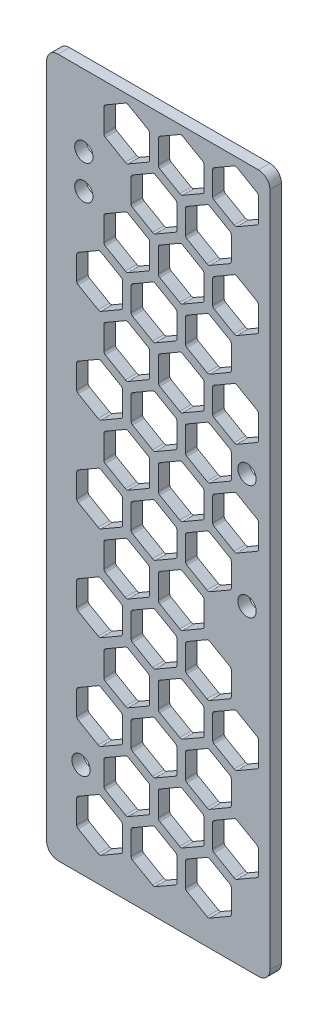
from build123d import *

# Parameters (mm, degrees)
SKETCH_1_R          = 1.6
EXTRUDE_1_DEPTH     = 2
SKETCH_3_W          = 13.038047159
SKETCH_3_H          = 8
SKETCH_3_W_2        = 14.361011955
CUT_EXTRUDE_2_DEPTH = 116.512986283
CUT_EXTRUDE_3_DEPTH = 114.570462709
FILLET_1_R          = 2


with BuildPart() as part:
    # 草图1 → 凸台-拉伸1 (new body)
    with BuildSketch(Plane.XY):
        Polygon((3, -11.5), (3, -16.5), (42, -16.5), (42, 8.5), (47, 8.5), (47, 16.5), (42, 16.5), (42, 72.5), (47, 72.5), (47, 80.5), (42, 80.5), (42, 105.5), (3, 105.5), align=None)
        with Locations((9, 0)):
            Circle(SKETCH_1_R, mode=Mode.SUBTRACT)
        with Locations((9.5, 93)):
            Circle(SKETCH_1_R, mode=Mode.SUBTRACT)
        with Locations((9.5, 87)):
            Circle(SKETCH_1_R, mode=Mode.SUBTRACT)
        with Locations((38, 38.5)):
            Circle(SKETCH_1_R, mode=Mode.SUBTRACT)
        with Locations((38, 58.5)):
            Circle(SKETCH_1_R, mode=Mode.SUBTRACT)
    extrude(amount=EXTRUDE_1_DEPTH)

    # 草图3 → 切除-拉伸2 (cut, through all)
    with BuildSketch(Plane.XY.offset(2)):
        with Locations((48.51902358, 76.5)):
            Rectangle(SKETCH_3_W, SKETCH_3_H)
        with Locations((49.180505978, 12.5)):
            Rectangle(SKETCH_3_W_2, SKETCH_3_H)
    extrude(amount=-CUT_EXTRUDE_2_DEPTH, mode=Mode.SUBTRACT)

    # 草图4 → 切除-拉伸3 (cut, through all)
    with BuildSketch(Plane.XY.offset(2)):
        with BuildLine():
            Line((35.75, 103.974464586), (32.25, 101.953738644))
            ThreePointArc((32.25, 101.953738644), (32.066987298, 101.770725942), (32, 101.520725942))
            Line((32, 101.520725942), (32, 97.479274058))
            ThreePointArc((32, 97.479274058), (32.066987298, 97.229274058), (32.25, 97.046261356))
            Line((32.25, 97.046261356), (35.75, 95.025535414))
            ThreePointArc((35.75, 95.025535414), (36, 94.958548116), (36.25, 95.025535414))
            Line((36.25, 95.025535414), (39.75, 97.046261356))
            ThreePointArc((39.75, 97.046261356), (39.933012702, 97.229274058), (40, 97.479274058))
            Line((40, 97.479274058), (40, 101.520725942))
            ThreePointArc((40, 101.520725942), (39.933012702, 101.770725942), (39.75, 101.953738644))
            Line((39.75, 101.953738644), (36.25, 103.974464586))
            ThreePointArc((36.25, 103.974464586), (36, 104.041451884), (35.75, 103.974464586))
        make_face()
        with BuildLine():
            Line((26.25, 103.974464586), (22.75, 101.953738644))
            ThreePointArc((22.75, 101.953738644), (22.566987298, 101.770725942), (22.5, 101.520725942))
            Line((22.5, 101.520725942), (22.5, 97.479274058))
            ThreePointArc((22.5, 97.479274058), (22.566987298, 97.229274058), (22.75, 97.046261356))
            Line((22.75, 97.046261356), (26.25, 95.025535414))
            ThreePointArc((26.25, 95.025535414), (26.5, 94.958548116), (26.75, 95.025535414))
            Line((26.75, 95.025535414), (30.25, 97.046261356))
            ThreePointArc((30.25, 97.046261356), (30.433012702, 97.229274058), (30.5, 97.479274058))
            Line((30.5, 97.479274058), (30.5, 101.520725942))
            ThreePointArc((30.5, 101.520725942), (30.433012702, 101.770725942), (30.25, 101.953738644))
            Line((30.25, 101.953738644), (26.75, 103.974464586))
            ThreePointArc((26.75, 103.974464586), (26.5, 104.041451884), (26.25, 103.974464586))
        make_face()
        with BuildLine():
            Line((16.75, 103.974464586), (13.25, 101.953738644))
            ThreePointArc((13.25, 101.953738644), (13.066987298, 101.770725942), (13, 101.520725942))
            Line((13, 101.520725942), (13, 97.479274058))
            ThreePointArc((13, 97.479274058), (13.066987298, 97.229274058), (13.25, 97.046261356))
            Line((13.25, 97.046261356), (16.75, 95.025535414))
            ThreePointArc((16.75, 95.025535414), (17, 94.958548116), (17.25, 95.025535414))
            Line((17.25, 95.025535414), (20.75, 97.046261356))
            ThreePointArc((20.75, 97.046261356), (20.933012702, 97.229274058), (21, 97.479274058))
            Line((21, 97.479274058), (21, 101.520725942))
            ThreePointArc((21, 101.520725942), (20.933012702, 101.770725942), (20.75, 101.953738644))
            Line((20.75, 101.953738644), (17.25, 103.974464586))
            ThreePointArc((17.25, 103.974464586), (17, 104.041451884), (16.75, 103.974464586))
        make_face()
        with BuildLine():
            Line((21.5, 95.74722325), (18, 93.726497308))
            ThreePointArc((18, 93.726497308), (17.816987298, 93.543484606), (17.75, 93.293484606))
            Line((17.75, 93.293484606), (17.75, 89.252032722))
            ThreePointArc((17.75, 89.252032722), (17.816987298, 89.002032722), (18, 88.81902002))
            Line((18, 88.81902002), (21.5, 86.798294078))
            ThreePointArc((21.5, 86.798294078), (21.75, 86.73130678), (22, 86.798294078))
            Line((22, 86.798294078), (25.5, 88.81902002))
            ThreePointArc((25.5, 88.81902002), (25.683012702, 89.002032722), (25.75, 89.252032722))
            Line((25.75, 89.252032722), (25.75, 93.293484606))
            ThreePointArc((25.75, 93.293484606), (25.683012702, 93.543484606), (25.5, 93.726497308))
            Line((25.5, 93.726497308), (22, 95.74722325))
            ThreePointArc((22, 95.74722325), (21.75, 95.814210548), (21.5, 95.74722325))
        make_face()
        with BuildLine():
            Line((31, 95.74722325), (27.5, 93.726497308))
            ThreePointArc((27.5, 93.726497308), (27.316987298, 93.543484606), (27.25, 93.293484606))
            Line((27.25, 93.293484606), (27.25, 89.252032722))
            ThreePointArc((27.25, 89.252032722), (27.316987298, 89.002032722), (27.5, 88.81902002))
            Line((27.5, 88.81902002), (31, 86.798294078))
            ThreePointArc((31, 86.798294078), (31.25, 86.73130678), (31.5, 86.798294078))
            Line((31.5, 86.798294078), (35, 88.81902002))
            ThreePointArc((35, 88.81902002), (35.183012702, 89.002032722), (35.25, 89.252032722))
            Line((35.25, 89.252032722), (35.25, 93.293484606))
            ThreePointArc((35.25, 93.293484606), (35.183012702, 93.543484606), (35, 93.726497308))
            Line((35, 93.726497308), (31.5, 95.74722325))
            ThreePointArc((31.5, 95.74722325), (31.25, 95.814210548), (31, 95.74722325))
        make_face()
        with BuildLine():
            Line((26.25, 87.519981914), (22.75, 85.499255972))
            ThreePointArc((22.75, 85.499255972), (22.566987298, 85.31624327), (22.5, 85.06624327))
            Line((22.5, 85.06624327), (22.5, 81.024791386))
            ThreePointArc((22.5, 81.024791386), (22.566987298, 80.774791386), (22.75, 80.591778684))
            Line((22.75, 80.591778684), (26.25, 78.571052742))
            ThreePointArc((26.25, 78.571052742), (26.5, 78.504065444), (26.75, 78.571052742))
            Line((26.75, 78.571052742), (30.25, 80.591778684))
            ThreePointArc((30.25, 80.591778684), (30.433012702, 80.774791386), (30.5, 81.024791386))
            Line((30.5, 81.024791386), (30.5, 85.06624327))
            ThreePointArc((30.5, 85.06624327), (30.433012702, 85.31624327), (30.25, 85.499255972))
            Line((30.25, 85.499255972), (26.75, 87.519981914))
            ThreePointArc((26.75, 87.519981914), (26.5, 87.586969212), (26.25, 87.519981914))
        make_face()
        with BuildLine():
            Line((35.75, 87.519981914), (32.25, 85.499255972))
            ThreePointArc((32.25, 85.499255972), (32.066987298, 85.31624327), (32, 85.06624327))
            Line((32, 85.06624327), (32, 81.024791386))
            ThreePointArc((32, 81.024791386), (32.066987298, 80.774791386), (32.25, 80.591778684))
            Line((32.25, 80.591778684), (35.75, 78.571052742))
            ThreePointArc((35.75, 78.571052742), (36, 78.504065444), (36.25, 78.571052742))
            Line((36.25, 78.571052742), (39.75, 80.591778684))
            ThreePointArc((39.75, 80.591778684), (39.933012702, 80.774791386), (40, 81.024791386))
            Line((40, 81.024791386), (40, 85.06624327))
            ThreePointArc((40, 85.06624327), (39.933012702, 85.31624327), (39.75, 85.499255972))
            Line((39.75, 85.499255972), (36.25, 87.519981914))
            ThreePointArc((36.25, 87.519981914), (36, 87.586969212), (35.75, 87.519981914))
        make_face()
        with BuildLine():
            Line((16.75, 87.519981914), (13.25, 85.499255972))
            ThreePointArc((13.25, 85.499255972), (13.066987298, 85.31624327), (13, 85.06624327))
            Line((13, 85.06624327), (13, 81.024791386))
            ThreePointArc((13, 81.024791386), (13.066987298, 80.774791386), (13.25, 80.591778684))
            Line((13.25, 80.591778684), (16.75, 78.571052742))
            ThreePointArc((16.75, 78.571052742), (17, 78.504065444), (17.25, 78.571052742))
            Line((17.25, 78.571052742), (20.75, 80.591778684))
            ThreePointArc((20.75, 80.591778684), (20.933012702, 80.774791386), (21, 81.024791386))
            Line((21, 81.024791386), (21, 85.06624327))
            ThreePointArc((21, 85.06624327), (20.933012702, 85.31624327), (20.75, 85.499255972))
            Line((20.75, 85.499255972), (17.25, 87.519981914))
            ThreePointArc((17.25, 87.519981914), (17, 87.586969212), (16.75, 87.519981914))
        make_face()
        with BuildLine():
            Line((21.5, 79.292740578), (18, 77.272014636))
            ThreePointArc((18, 77.272014636), (17.816987298, 77.089001934), (17.75, 76.839001934))
            Line((17.75, 76.839001934), (17.75, 72.79755005))
            ThreePointArc((17.75, 72.79755005), (17.816987298, 72.54755005), (18, 72.364537348))
            Line((18, 72.364537348), (21.5, 70.343811406))
            ThreePointArc((21.5, 70.343811406), (21.75, 70.276824108), (22, 70.343811406))
            Line((22, 70.343811406), (25.5, 72.364537348))
            ThreePointArc((25.5, 72.364537348), (25.683012702, 72.54755005), (25.75, 72.79755005))
            Line((25.75, 72.79755005), (25.75, 76.839001934))
            ThreePointArc((25.75, 76.839001934), (25.683012702, 77.089001934), (25.5, 77.272014636))
            Line((25.5, 77.272014636), (22, 79.292740578))
            ThreePointArc((22, 79.292740578), (21.75, 79.359727876), (21.5, 79.292740578))
        make_face()
        with BuildLine():
            Line((31, 79.292740578), (27.5, 77.272014636))
            ThreePointArc((27.5, 77.272014636), (27.316987298, 77.089001934), (27.25, 76.839001934))
            Line((27.25, 76.839001934), (27.25, 72.79755005))
            ThreePointArc((27.25, 72.79755005), (27.316987298, 72.54755005), (27.5, 72.364537348))
            Line((27.5, 72.364537348), (31, 70.343811406))
            ThreePointArc((31, 70.343811406), (31.25, 70.276824108), (31.5, 70.343811406))
            Line((31.5, 70.343811406), (35, 72.364537348))
            ThreePointArc((35, 72.364537348), (35.183012702, 72.54755005), (35.25, 72.79755005))
            Line((35.25, 72.79755005), (35.25, 76.839001934))
            ThreePointArc((35.25, 76.839001934), (35.183012702, 77.089001934), (35, 77.272014636))
            Line((35, 77.272014636), (31.5, 79.292740578))
            ThreePointArc((31.5, 79.292740578), (31.25, 79.359727876), (31, 79.292740578))
        make_face()
        with BuildLine():
            Line((12, 79.292740578), (8.5, 77.272014636))
            ThreePointArc((8.5, 77.272014636), (8.316987298, 77.089001934), (8.25, 76.839001934))
            Line((8.25, 76.839001934), (8.25, 72.79755005))
            ThreePointArc((8.25, 72.79755005), (8.316987298, 72.54755005), (8.5, 72.364537348))
            Line((8.5, 72.364537348), (12, 70.343811406))
            ThreePointArc((12, 70.343811406), (12.25, 70.276824108), (12.5, 70.343811406))
            Line((12.5, 70.343811406), (16, 72.364537348))
            ThreePointArc((16, 72.364537348), (16.183012702, 72.54755005), (16.25, 72.79755005))
            Line((16.25, 72.79755005), (16.25, 76.839001934))
            ThreePointArc((16.25, 76.839001934), (16.183012702, 77.089001934), (16, 77.272014636))
            Line((16, 77.272014636), (12.5, 79.292740578))
            ThreePointArc((12.5, 79.292740578), (12.25, 79.359727876), (12, 79.292740578))
        make_face()
        with BuildLine():
            Line((16.75, 71.065499242), (13.25, 69.0447733))
            ThreePointArc((13.25, 69.0447733), (13.066987298, 68.861760598), (13, 68.611760598))
            Line((13, 68.611760598), (13, 64.570308714))
            ThreePointArc((13, 64.570308714), (13.066987298, 64.320308714), (13.25, 64.137296012))
            Line((13.25, 64.137296012), (16.75, 62.11657007))
            ThreePointArc((16.75, 62.11657007), (17, 62.049582772), (17.25, 62.11657007))
            Line((17.25, 62.11657007), (20.75, 64.137296012))
            ThreePointArc((20.75, 64.137296012), (20.933012702, 64.320308714), (21, 64.570308714))
            Line((21, 64.570308714), (21, 68.611760598))
            ThreePointArc((21, 68.611760598), (20.933012702, 68.861760598), (20.75, 69.0447733))
            Line((20.75, 69.0447733), (17.25, 71.065499242))
            ThreePointArc((17.25, 71.065499242), (17, 71.132486541), (16.75, 71.065499242))
        make_face()
        with BuildLine():
            Line((26.25, 71.065499242), (22.75, 69.0447733))
            ThreePointArc((22.75, 69.0447733), (22.566987298, 68.861760598), (22.5, 68.611760598))
            Line((22.5, 68.611760598), (22.5, 64.570308714))
            ThreePointArc((22.5, 64.570308714), (22.566987298, 64.320308714), (22.75, 64.137296012))
            Line((22.75, 64.137296012), (26.25, 62.11657007))
            ThreePointArc((26.25, 62.11657007), (26.5, 62.049582772), (26.75, 62.11657007))
            Line((26.75, 62.11657007), (30.25, 64.137296012))
            ThreePointArc((30.25, 64.137296012), (30.433012702, 64.320308714), (30.5, 64.570308714))
            Line((30.5, 64.570308714), (30.5, 68.611760598))
            ThreePointArc((30.5, 68.611760598), (30.433012702, 68.861760598), (30.25, 69.0447733))
            Line((30.25, 69.0447733), (26.75, 71.065499242))
            ThreePointArc((26.75, 71.065499242), (26.5, 71.132486541), (26.25, 71.065499242))
        make_face()
        with BuildLine():
            Line((35.75, 71.065499242), (32.25, 69.0447733))
            ThreePointArc((32.25, 69.0447733), (32.066987298, 68.861760598), (32, 68.611760598))
            Line((32, 68.611760598), (32, 64.570308714))
            ThreePointArc((32, 64.570308714), (32.066987298, 64.320308714), (32.25, 64.137296012))
            Line((32.25, 64.137296012), (35.75, 62.11657007))
            ThreePointArc((35.75, 62.11657007), (36, 62.049582772), (36.25, 62.11657007))
            Line((36.25, 62.11657007), (39.75, 64.137296012))
            ThreePointArc((39.75, 64.137296012), (39.933012702, 64.320308714), (40, 64.570308714))
            Line((40, 64.570308714), (40, 68.611760598))
            ThreePointArc((40, 68.611760598), (39.933012702, 68.861760598), (39.75, 69.0447733))
            Line((39.75, 69.0447733), (36.25, 71.065499242))
            ThreePointArc((36.25, 71.065499242), (36, 71.132486541), (35.75, 71.065499242))
        make_face()
        with BuildLine():
            Line((31, 62.838257906), (27.5, 60.817531964))
            ThreePointArc((27.5, 60.817531964), (27.316987298, 60.634519262), (27.25, 60.384519262))
            Line((27.25, 60.384519262), (27.25, 56.343067378))
            ThreePointArc((27.25, 56.343067378), (27.316987298, 56.093067378), (27.5, 55.910054676))
            Line((27.5, 55.910054676), (31, 53.889328734))
            ThreePointArc((31, 53.889328734), (31.25, 53.822341436), (31.5, 53.889328734))
            Line((31.5, 53.889328734), (35, 55.910054676))
            ThreePointArc((35, 55.910054676), (35.183012702, 56.093067378), (35.25, 56.343067378))
            Line((35.25, 56.343067378), (35.25, 60.384519262))
            ThreePointArc((35.25, 60.384519262), (35.183012702, 60.634519262), (35, 60.817531964))
            Line((35, 60.817531964), (31.5, 62.838257906))
            ThreePointArc((31.5, 62.838257906), (31.25, 62.905245205), (31, 62.838257906))
        make_face()
        with BuildLine():
            Line((21.5, 62.838257906), (18, 60.817531964))
            ThreePointArc((18, 60.817531964), (17.816987298, 60.634519262), (17.75, 60.384519262))
            Line((17.75, 60.384519262), (17.75, 56.343067378))
            ThreePointArc((17.75, 56.343067378), (17.816987298, 56.093067378), (18, 55.910054676))
            Line((18, 55.910054676), (21.5, 53.889328734))
            ThreePointArc((21.5, 53.889328734), (21.75, 53.822341436), (22, 53.889328734))
            Line((22, 53.889328734), (25.5, 55.910054676))
            ThreePointArc((25.5, 55.910054676), (25.683012702, 56.093067378), (25.75, 56.343067378))
            Line((25.75, 56.343067378), (25.75, 60.384519262))
            ThreePointArc((25.75, 60.384519262), (25.683012702, 60.634519262), (25.5, 60.817531964))
            Line((25.5, 60.817531964), (22, 62.838257906))
            ThreePointArc((22, 62.838257906), (21.75, 62.905245205), (21.5, 62.838257906))
        make_face()
        with BuildLine():
            Line((12, 62.838257906), (8.5, 60.817531964))
            ThreePointArc((8.5, 60.817531964), (8.316987298, 60.634519262), (8.25, 60.384519262))
            Line((8.25, 60.384519262), (8.25, 56.343067378))
            ThreePointArc((8.25, 56.343067378), (8.316987298, 56.093067378), (8.5, 55.910054676))
            Line((8.5, 55.910054676), (12, 53.889328734))
            ThreePointArc((12, 53.889328734), (12.25, 53.822341436), (12.5, 53.889328734))
            Line((12.5, 53.889328734), (16, 55.910054676))
            ThreePointArc((16, 55.910054676), (16.183012702, 56.093067378), (16.25, 56.343067378))
            Line((16.25, 56.343067378), (16.25, 60.384519262))
            ThreePointArc((16.25, 60.384519262), (16.183012702, 60.634519262), (16, 60.817531964))
            Line((16, 60.817531964), (12.5, 62.838257906))
            ThreePointArc((12.5, 62.838257906), (12.25, 62.905245205), (12, 62.838257906))
        make_face()
        with BuildLine():
            Line((16.75, 54.611016571), (13.25, 52.590290628))
            ThreePointArc((13.25, 52.590290628), (13.066987298, 52.407277926), (13, 52.157277926))
            Line((13, 52.157277926), (13, 48.115826042))
            ThreePointArc((13, 48.115826042), (13.066987298, 47.865826042), (13.25, 47.68281334))
            Line((13.25, 47.68281334), (16.75, 45.662087398))
            ThreePointArc((16.75, 45.662087398), (17, 45.5951001), (17.25, 45.662087398))
            Line((17.25, 45.662087398), (20.75, 47.68281334))
            ThreePointArc((20.75, 47.68281334), (20.933012702, 47.865826042), (21, 48.115826042))
            Line((21, 48.115826042), (21, 52.157277926))
            ThreePointArc((21, 52.157277926), (20.933012702, 52.407277926), (20.75, 52.590290628))
            Line((20.75, 52.590290628), (17.25, 54.611016571))
            ThreePointArc((17.25, 54.611016571), (17, 54.678003869), (16.75, 54.611016571))
        make_face()
        with BuildLine():
            Line((26.25, 54.611016571), (22.75, 52.590290628))
            ThreePointArc((22.75, 52.590290628), (22.566987298, 52.407277926), (22.5, 52.157277926))
            Line((22.5, 52.157277926), (22.5, 48.115826042))
            ThreePointArc((22.5, 48.115826042), (22.566987298, 47.865826042), (22.75, 47.68281334))
            Line((22.75, 47.68281334), (26.25, 45.662087398))
            ThreePointArc((26.25, 45.662087398), (26.5, 45.5951001), (26.75, 45.662087398))
            Line((26.75, 45.662087398), (30.25, 47.68281334))
            ThreePointArc((30.25, 47.68281334), (30.433012702, 47.865826042), (30.5, 48.115826042))
            Line((30.5, 48.115826042), (30.5, 52.157277926))
            ThreePointArc((30.5, 52.157277926), (30.433012702, 52.407277926), (30.25, 52.590290628))
            Line((30.25, 52.590290628), (26.75, 54.611016571))
            ThreePointArc((26.75, 54.611016571), (26.5, 54.678003869), (26.25, 54.611016571))
        make_face()
        with BuildLine():
            Line((35.75, 54.611016571), (32.25, 52.590290628))
            ThreePointArc((32.25, 52.590290628), (32.066987298, 52.407277926), (32, 52.157277926))
            Line((32, 52.157277926), (32, 48.115826042))
            ThreePointArc((32, 48.115826042), (32.066987298, 47.865826042), (32.25, 47.68281334))
            Line((32.25, 47.68281334), (35.75, 45.662087398))
            ThreePointArc((35.75, 45.662087398), (36, 45.5951001), (36.25, 45.662087398))
            Line((36.25, 45.662087398), (39.75, 47.68281334))
            ThreePointArc((39.75, 47.68281334), (39.933012702, 47.865826042), (40, 48.115826042))
            Line((40, 48.115826042), (40, 52.157277926))
            ThreePointArc((40, 52.157277926), (39.933012702, 52.407277926), (39.75, 52.590290628))
            Line((39.75, 52.590290628), (36.25, 54.611016571))
            ThreePointArc((36.25, 54.611016571), (36, 54.678003869), (35.75, 54.611016571))
        make_face()
        with BuildLine():
            Line((31, 46.383775235), (27.5, 44.363049292))
            ThreePointArc((27.5, 44.363049292), (27.316987298, 44.18003659), (27.25, 43.93003659))
            Line((27.25, 43.93003659), (27.25, 39.888584706))
            ThreePointArc((27.25, 39.888584706), (27.316987298, 39.638584706), (27.5, 39.455572004))
            Line((27.5, 39.455572004), (31, 37.434846062))
            ThreePointArc((31, 37.434846062), (31.25, 37.367858764), (31.5, 37.434846062))
            Line((31.5, 37.434846062), (35, 39.455572004))
            ThreePointArc((35, 39.455572004), (35.183012702, 39.638584706), (35.25, 39.888584706))
            Line((35.25, 39.888584706), (35.25, 43.93003659))
            ThreePointArc((35.25, 43.93003659), (35.183012702, 44.18003659), (35, 44.363049292))
            Line((35, 44.363049292), (31.5, 46.383775235))
            ThreePointArc((31.5, 46.383775235), (31.25, 46.450762533), (31, 46.383775235))
        make_face()
        with BuildLine():
            Line((21.5, 46.383775235), (18, 44.363049292))
            ThreePointArc((18, 44.363049292), (17.816987298, 44.18003659), (17.75, 43.93003659))
            Line((17.75, 43.93003659), (17.75, 39.888584706))
            ThreePointArc((17.75, 39.888584706), (17.816987298, 39.638584706), (18, 39.455572004))
            Line((18, 39.455572004), (21.5, 37.434846062))
            ThreePointArc((21.5, 37.434846062), (21.75, 37.367858764), (22, 37.434846062))
            Line((22, 37.434846062), (25.5, 39.455572004))
            ThreePointArc((25.5, 39.455572004), (25.683012702, 39.638584706), (25.75, 39.888584706))
            Line((25.75, 39.888584706), (25.75, 43.93003659))
            ThreePointArc((25.75, 43.93003659), (25.683012702, 44.18003659), (25.5, 44.363049292))
            Line((25.5, 44.363049292), (22, 46.383775235))
            ThreePointArc((22, 46.383775235), (21.75, 46.450762533), (21.5, 46.383775235))
        make_face()
        with BuildLine():
            Line((12, 46.383775235), (8.5, 44.363049292))
            ThreePointArc((8.5, 44.363049292), (8.316987298, 44.18003659), (8.25, 43.93003659))
            Line((8.25, 43.93003659), (8.25, 39.888584706))
            ThreePointArc((8.25, 39.888584706), (8.316987298, 39.638584706), (8.5, 39.455572004))
            Line((8.5, 39.455572004), (12, 37.434846062))
            ThreePointArc((12, 37.434846062), (12.25, 37.367858764), (12.5, 37.434846062))
            Line((12.5, 37.434846062), (16, 39.455572004))
            ThreePointArc((16, 39.455572004), (16.183012702, 39.638584706), (16.25, 39.888584706))
            Line((16.25, 39.888584706), (16.25, 43.93003659))
            ThreePointArc((16.25, 43.93003659), (16.183012702, 44.18003659), (16, 44.363049292))
            Line((16, 44.363049292), (12.5, 46.383775235))
            ThreePointArc((12.5, 46.383775235), (12.25, 46.450762533), (12, 46.383775235))
        make_face()
        with BuildLine():
            Line((16.75, 38.156533899), (13.25, 36.135807956))
            ThreePointArc((13.25, 36.135807956), (13.066987298, 35.952795255), (13, 35.702795255))
            Line((13, 35.702795255), (13, 31.66134337))
            ThreePointArc((13, 31.66134337), (13.066987298, 31.41134337), (13.25, 31.228330668))
            Line((13.25, 31.228330668), (16.75, 29.207604726))
            ThreePointArc((16.75, 29.207604726), (17, 29.140617428), (17.25, 29.207604726))
            Line((17.25, 29.207604726), (20.75, 31.228330668))
            ThreePointArc((20.75, 31.228330668), (20.933012702, 31.41134337), (21, 31.66134337))
            Line((21, 31.66134337), (21, 35.702795255))
            ThreePointArc((21, 35.702795255), (20.933012702, 35.952795255), (20.75, 36.135807956))
            Line((20.75, 36.135807956), (17.25, 38.156533899))
            ThreePointArc((17.25, 38.156533899), (17, 38.223521197), (16.75, 38.156533899))
        make_face()
        with BuildLine():
            Line((26.25, 38.156533899), (22.75, 36.135807956))
            ThreePointArc((22.75, 36.135807956), (22.566987298, 35.952795255), (22.5, 35.702795255))
            Line((22.5, 35.702795255), (22.5, 31.66134337))
            ThreePointArc((22.5, 31.66134337), (22.566987298, 31.41134337), (22.75, 31.228330668))
            Line((22.75, 31.228330668), (26.25, 29.207604726))
            ThreePointArc((26.25, 29.207604726), (26.5, 29.140617428), (26.75, 29.207604726))
            Line((26.75, 29.207604726), (30.25, 31.228330668))
            ThreePointArc((30.25, 31.228330668), (30.433012702, 31.41134337), (30.5, 31.66134337))
            Line((30.5, 31.66134337), (30.5, 35.702795255))
            ThreePointArc((30.5, 35.702795255), (30.433012702, 35.952795255), (30.25, 36.135807956))
            Line((30.25, 36.135807956), (26.75, 38.156533899))
            ThreePointArc((26.75, 38.156533899), (26.5, 38.223521197), (26.25, 38.156533899))
        make_face()
        with BuildLine():
            Line((31, 29.929292563), (27.5, 27.90856662))
            ThreePointArc((27.5, 27.90856662), (27.316987298, 27.725553919), (27.25, 27.475553919))
            Line((27.25, 27.475553919), (27.25, 23.434102034))
            ThreePointArc((27.25, 23.434102034), (27.316987298, 23.184102034), (27.5, 23.001089332))
            Line((27.5, 23.001089332), (31, 20.98036339))
            ThreePointArc((31, 20.98036339), (31.25, 20.913376092), (31.5, 20.98036339))
            Line((31.5, 20.98036339), (35, 23.001089332))
            ThreePointArc((35, 23.001089332), (35.183012702, 23.184102034), (35.25, 23.434102034))
            Line((35.25, 23.434102034), (35.25, 27.475553919))
            ThreePointArc((35.25, 27.475553919), (35.183012702, 27.725553919), (35, 27.90856662))
            Line((35, 27.90856662), (31.5, 29.929292563))
            ThreePointArc((31.5, 29.929292563), (31.25, 29.996279861), (31, 29.929292563))
        make_face()
        with BuildLine():
            Line((21.5, 29.929292563), (18, 27.90856662))
            ThreePointArc((18, 27.90856662), (17.816987298, 27.725553919), (17.75, 27.475553919))
            Line((17.75, 27.475553919), (17.75, 23.434102034))
            ThreePointArc((17.75, 23.434102034), (17.816987298, 23.184102034), (18, 23.001089332))
            Line((18, 23.001089332), (21.5, 20.98036339))
            ThreePointArc((21.5, 20.98036339), (21.75, 20.913376092), (22, 20.98036339))
            Line((22, 20.98036339), (25.5, 23.001089332))
            ThreePointArc((25.5, 23.001089332), (25.683012702, 23.184102034), (25.75, 23.434102034))
            Line((25.75, 23.434102034), (25.75, 27.475553919))
            ThreePointArc((25.75, 27.475553919), (25.683012702, 27.725553919), (25.5, 27.90856662))
            Line((25.5, 27.90856662), (22, 29.929292563))
            ThreePointArc((22, 29.929292563), (21.75, 29.996279861), (21.5, 29.929292563))
        make_face()
        with BuildLine():
            Line((12, 29.929292563), (8.5, 27.90856662))
            ThreePointArc((8.5, 27.90856662), (8.316987298, 27.725553919), (8.25, 27.475553919))
            Line((8.25, 27.475553919), (8.25, 23.434102034))
            ThreePointArc((8.25, 23.434102034), (8.316987298, 23.184102034), (8.5, 23.001089332))
            Line((8.5, 23.001089332), (12, 20.98036339))
            ThreePointArc((12, 20.98036339), (12.25, 20.913376092), (12.5, 20.98036339))
            Line((12.5, 20.98036339), (16, 23.001089332))
            ThreePointArc((16, 23.001089332), (16.183012702, 23.184102034), (16.25, 23.434102034))
            Line((16.25, 23.434102034), (16.25, 27.475553919))
            ThreePointArc((16.25, 27.475553919), (16.183012702, 27.725553919), (16, 27.90856662))
            Line((16, 27.90856662), (12.5, 29.929292563))
            ThreePointArc((12.5, 29.929292563), (12.25, 29.996279861), (12, 29.929292563))
        make_face()
        with BuildLine():
            Line((16.75, 21.702051227), (13.25, 19.681325285))
            ThreePointArc((13.25, 19.681325285), (13.066987298, 19.498312583), (13, 19.248312583))
            Line((13, 19.248312583), (13, 15.206860698))
            ThreePointArc((13, 15.206860698), (13.066987298, 14.956860698), (13.25, 14.773847996))
            Line((13.25, 14.773847996), (16.75, 12.753122054))
            ThreePointArc((16.75, 12.753122054), (17, 12.686134756), (17.25, 12.753122054))
            Line((17.25, 12.753122054), (20.75, 14.773847996))
            ThreePointArc((20.75, 14.773847996), (20.933012702, 14.956860698), (21, 15.206860698))
            Line((21, 15.206860698), (21, 19.248312583))
            ThreePointArc((21, 19.248312583), (20.933012702, 19.498312583), (20.75, 19.681325285))
            Line((20.75, 19.681325285), (17.25, 21.702051227))
            ThreePointArc((17.25, 21.702051227), (17, 21.769038525), (16.75, 21.702051227))
        make_face()
        with BuildLine():
            Line((26.25, 21.702051227), (22.75, 19.681325285))
            ThreePointArc((22.75, 19.681325285), (22.566987298, 19.498312583), (22.5, 19.248312583))
            Line((22.5, 19.248312583), (22.5, 15.206860698))
            ThreePointArc((22.5, 15.206860698), (22.566987298, 14.956860698), (22.75, 14.773847996))
            Line((22.75, 14.773847996), (26.25, 12.753122054))
            ThreePointArc((26.25, 12.753122054), (26.5, 12.686134756), (26.75, 12.753122054))
            Line((26.75, 12.753122054), (30.25, 14.773847996))
            ThreePointArc((30.25, 14.773847996), (30.433012702, 14.956860698), (30.5, 15.206860698))
            Line((30.5, 15.206860698), (30.5, 19.248312583))
            ThreePointArc((30.5, 19.248312583), (30.433012702, 19.498312583), (30.25, 19.681325285))
            Line((30.25, 19.681325285), (26.75, 21.702051227))
            ThreePointArc((26.75, 21.702051227), (26.5, 21.769038525), (26.25, 21.702051227))
        make_face()
        with BuildLine():
            Line((35.75, 21.702051227), (32.25, 19.681325285))
            ThreePointArc((32.25, 19.681325285), (32.066987298, 19.498312583), (32, 19.248312583))
            Line((32, 19.248312583), (32, 15.206860698))
            ThreePointArc((32, 15.206860698), (32.066987298, 14.956860698), (32.25, 14.773847996))
            Line((32.25, 14.773847996), (35.75, 12.753122054))
            ThreePointArc((35.75, 12.753122054), (36, 12.686134756), (36.25, 12.753122054))
            Line((36.25, 12.753122054), (39.75, 14.773847996))
            ThreePointArc((39.75, 14.773847996), (39.933012702, 14.956860698), (40, 15.206860698))
            Line((40, 15.206860698), (40, 19.248312583))
            ThreePointArc((40, 19.248312583), (39.933012702, 19.498312583), (39.75, 19.681325285))
            Line((39.75, 19.681325285), (36.25, 21.702051227))
            ThreePointArc((36.25, 21.702051227), (36, 21.769038525), (35.75, 21.702051227))
        make_face()
        with BuildLine():
            Line((31, 13.474809891), (27.5, 11.454083949))
            ThreePointArc((27.5, 11.454083949), (27.316987298, 11.271071247), (27.25, 11.021071247))
            Line((27.25, 11.021071247), (27.25, 6.979619362))
            ThreePointArc((27.25, 6.979619362), (27.316987298, 6.729619362), (27.5, 6.54660666))
            Line((27.5, 6.54660666), (31, 4.525880718))
            ThreePointArc((31, 4.525880718), (31.25, 4.45889342), (31.5, 4.525880718))
            Line((31.5, 4.525880718), (35, 6.54660666))
            ThreePointArc((35, 6.54660666), (35.183012702, 6.729619362), (35.25, 6.979619362))
            Line((35.25, 6.979619362), (35.25, 11.021071247))
            ThreePointArc((35.25, 11.021071247), (35.183012702, 11.271071247), (35, 11.454083949))
            Line((35, 11.454083949), (31.5, 13.474809891))
            ThreePointArc((31.5, 13.474809891), (31.25, 13.541797189), (31, 13.474809891))
        make_face()
        with BuildLine():
            Line((21.5, 13.474809891), (18, 11.454083949))
            ThreePointArc((18, 11.454083949), (17.816987298, 11.271071247), (17.75, 11.021071247))
            Line((17.75, 11.021071247), (17.75, 6.979619362))
            ThreePointArc((17.75, 6.979619362), (17.816987298, 6.729619362), (18, 6.54660666))
            Line((18, 6.54660666), (21.5, 4.525880718))
            ThreePointArc((21.5, 4.525880718), (21.75, 4.45889342), (22, 4.525880718))
            Line((22, 4.525880718), (25.5, 6.54660666))
            ThreePointArc((25.5, 6.54660666), (25.683012702, 6.729619362), (25.75, 6.979619362))
            Line((25.75, 6.979619362), (25.75, 11.021071247))
            ThreePointArc((25.75, 11.021071247), (25.683012702, 11.271071247), (25.5, 11.454083949))
            Line((25.5, 11.454083949), (22, 13.474809891))
            ThreePointArc((22, 13.474809891), (21.75, 13.541797189), (21.5, 13.474809891))
        make_face()
        with BuildLine():
            Line((12, 13.474809891), (8.5, 11.454083949))
            ThreePointArc((8.5, 11.454083949), (8.316987298, 11.271071247), (8.25, 11.021071247))
            Line((8.25, 11.021071247), (8.25, 6.979619362))
            ThreePointArc((8.25, 6.979619362), (8.316987298, 6.729619362), (8.5, 6.54660666))
            Line((8.5, 6.54660666), (12, 4.525880718))
            ThreePointArc((12, 4.525880718), (12.25, 4.45889342), (12.5, 4.525880718))
            Line((12.5, 4.525880718), (16, 6.54660666))
            ThreePointArc((16, 6.54660666), (16.183012702, 6.729619362), (16.25, 6.979619362))
            Line((16.25, 6.979619362), (16.25, 11.021071247))
            ThreePointArc((16.25, 11.021071247), (16.183012702, 11.271071247), (16, 11.454083949))
            Line((16, 11.454083949), (12.5, 13.474809891))
            ThreePointArc((12.5, 13.474809891), (12.25, 13.541797189), (12, 13.474809891))
        make_face()
        with BuildLine():
            Line((16.75, 5.247568555), (13.25, 3.226842613))
            ThreePointArc((13.25, 3.226842613), (13.066987298, 3.043829911), (13, 2.793829911))
            Line((13, 2.793829911), (13, -1.247621974))
            ThreePointArc((13, -1.247621974), (13.066987298, -1.497621974), (13.25, -1.680634675))
            Line((13.25, -1.680634675), (16.75, -3.701360618))
            ThreePointArc((16.75, -3.701360618), (17, -3.768347916), (17.25, -3.701360618))
            Line((17.25, -3.701360618), (20.75, -1.680634675))
            ThreePointArc((20.75, -1.680634675), (20.933012702, -1.497621974), (21, -1.247621974))
            Line((21, -1.247621974), (21, 2.793829911))
            ThreePointArc((21, 2.793829911), (20.933012702, 3.043829911), (20.75, 3.226842613))
            Line((20.75, 3.226842613), (17.25, 5.247568555))
            ThreePointArc((17.25, 5.247568555), (17, 5.314555853), (16.75, 5.247568555))
        make_face()
        with BuildLine():
            Line((26.25, 5.247568555), (22.75, 3.226842613))
            ThreePointArc((22.75, 3.226842613), (22.566987298, 3.043829911), (22.5, 2.793829911))
            Line((22.5, 2.793829911), (22.5, -1.247621974))
            ThreePointArc((22.5, -1.247621974), (22.566987298, -1.497621974), (22.75, -1.680634675))
            Line((22.75, -1.680634675), (26.25, -3.701360618))
            ThreePointArc((26.25, -3.701360618), (26.5, -3.768347916), (26.75, -3.701360618))
            Line((26.75, -3.701360618), (30.25, -1.680634675))
            ThreePointArc((30.25, -1.680634675), (30.433012702, -1.497621974), (30.5, -1.247621974))
            Line((30.5, -1.247621974), (30.5, 2.793829911))
            ThreePointArc((30.5, 2.793829911), (30.433012702, 3.043829911), (30.25, 3.226842613))
            Line((30.25, 3.226842613), (26.75, 5.247568555))
            ThreePointArc((26.75, 5.247568555), (26.5, 5.314555853), (26.25, 5.247568555))
        make_face()
        with BuildLine():
            Line((35.75, 5.247568555), (32.25, 3.226842613))
            ThreePointArc((32.25, 3.226842613), (32.066987298, 3.043829911), (32, 2.793829911))
            Line((32, 2.793829911), (32, -1.247621974))
            ThreePointArc((32, -1.247621974), (32.066987298, -1.497621974), (32.25, -1.680634675))
            Line((32.25, -1.680634675), (35.75, -3.701360618))
            ThreePointArc((35.75, -3.701360618), (36, -3.768347916), (36.25, -3.701360618))
            Line((36.25, -3.701360618), (39.75, -1.680634675))
            ThreePointArc((39.75, -1.680634675), (39.933012702, -1.497621974), (40, -1.247621974))
            Line((40, -1.247621974), (40, 2.793829911))
            ThreePointArc((40, 2.793829911), (39.933012702, 3.043829911), (39.75, 3.226842613))
            Line((39.75, 3.226842613), (36.25, 5.247568555))
            ThreePointArc((36.25, 5.247568555), (36, 5.314555853), (35.75, 5.247568555))
        make_face()
        with BuildLine():
            Line((31, -2.979672781), (27.5, -5.000398723))
            ThreePointArc((27.5, -5.000398723), (27.316987298, -5.183411425), (27.25, -5.433411425))
            Line((27.25, -5.433411425), (27.25, -9.47486331))
            ThreePointArc((27.25, -9.47486331), (27.316987298, -9.72486331), (27.5, -9.907876011))
            Line((27.5, -9.907876011), (31, -11.928601954))
            ThreePointArc((31, -11.928601954), (31.25, -11.995589252), (31.5, -11.928601954))
            Line((31.5, -11.928601954), (35, -9.907876011))
            ThreePointArc((35, -9.907876011), (35.183012702, -9.72486331), (35.25, -9.47486331))
            Line((35.25, -9.47486331), (35.25, -5.433411425))
            ThreePointArc((35.25, -5.433411425), (35.183012702, -5.183411425), (35, -5.000398723))
            Line((35, -5.000398723), (31.5, -2.979672781))
            ThreePointArc((31.5, -2.979672781), (31.25, -2.912685483), (31, -2.979672781))
        make_face()
        with BuildLine():
            Line((21.5, -2.979672781), (18, -5.000398723))
            ThreePointArc((18, -5.000398723), (17.816987298, -5.183411425), (17.75, -5.433411425))
            Line((17.75, -5.433411425), (17.75, -9.47486331))
            ThreePointArc((17.75, -9.47486331), (17.816987298, -9.72486331), (18, -9.907876011))
            Line((18, -9.907876011), (21.5, -11.928601954))
            ThreePointArc((21.5, -11.928601954), (21.75, -11.995589252), (22, -11.928601954))
            Line((22, -11.928601954), (25.5, -9.907876011))
            ThreePointArc((25.5, -9.907876011), (25.683012702, -9.72486331), (25.75, -9.47486331))
            Line((25.75, -9.47486331), (25.75, -5.433411425))
            ThreePointArc((25.75, -5.433411425), (25.683012702, -5.183411425), (25.5, -5.000398723))
            Line((25.5, -5.000398723), (22, -2.979672781))
            ThreePointArc((22, -2.979672781), (21.75, -2.912685483), (21.5, -2.979672781))
        make_face()
        with BuildLine():
            Line((12, -2.979672781), (8.5, -5.000398723))
            ThreePointArc((8.5, -5.000398723), (8.316987298, -5.183411425), (8.25, -5.433411425))
            Line((8.25, -5.433411425), (8.25, -9.47486331))
            ThreePointArc((8.25, -9.47486331), (8.316987298, -9.72486331), (8.5, -9.907876011))
            Line((8.5, -9.907876011), (12, -11.928601954))
            ThreePointArc((12, -11.928601954), (12.25, -11.995589252), (12.5, -11.928601954))
            Line((12.5, -11.928601954), (16, -9.907876011))
            ThreePointArc((16, -9.907876011), (16.183012702, -9.72486331), (16.25, -9.47486331))
            Line((16.25, -9.47486331), (16.25, -5.433411425))
            ThreePointArc((16.25, -5.433411425), (16.183012702, -5.183411425), (16, -5.000398723))
            Line((16, -5.000398723), (12.5, -2.979672781))
            ThreePointArc((12.5, -2.979672781), (12.25, -2.912685483), (12, -2.979672781))
        make_face()
    extrude(amount=-CUT_EXTRUDE_3_DEPTH, mode=Mode.SUBTRACT)

    # 圆角1
    fillet_1_edges = [part.edges().sort_by_distance(p)[0] for p in [
        (3, 105.5, 1),
        (42, 105.5, 1),
        (42, -16.5, 1),
        (3, -16.5, 1),
    ]]
    fillet(fillet_1_edges, radius=FILLET_1_R)


solid = part.part
